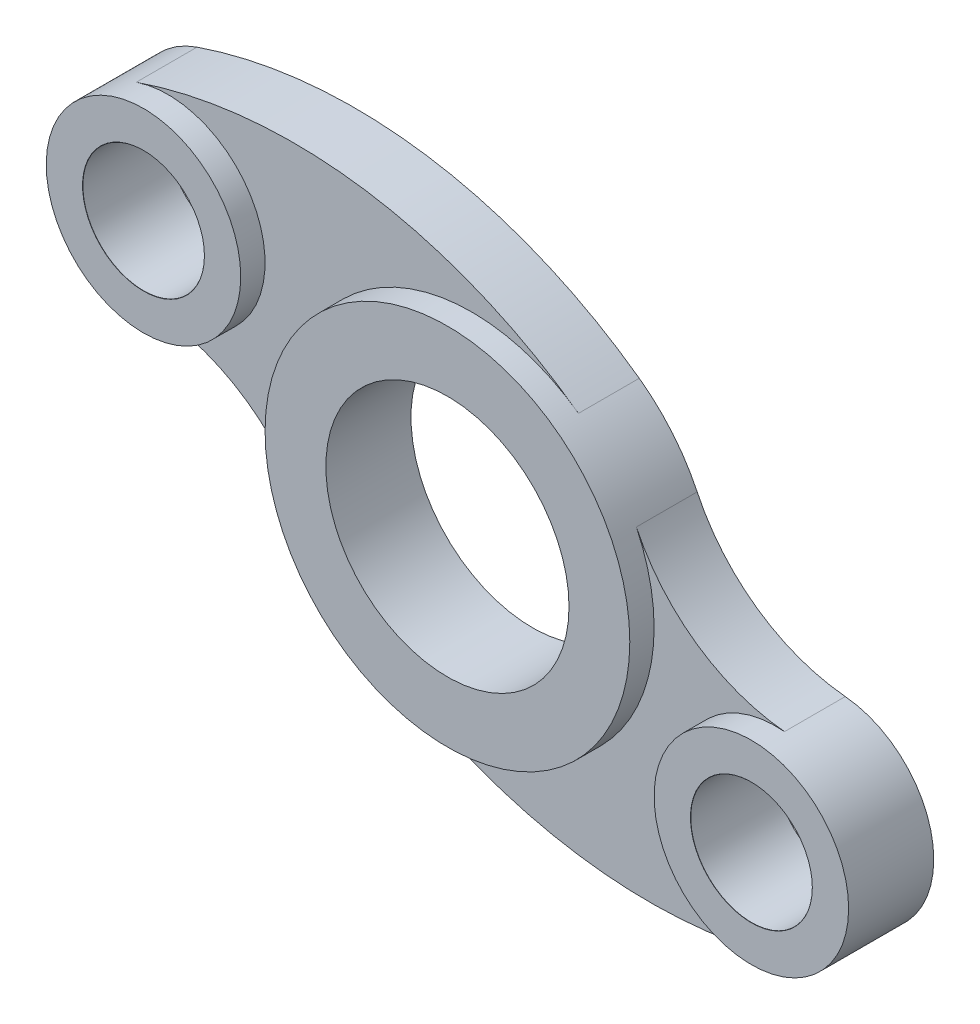
from build123d import *

# Parameters (mm, degrees)
ESTRUSIONE_ESTRUSIONE1_START = -5
SCHIZZO1_R                   = 16
ESTRUSIONE_ESTRUSIONE1_DEPTH = 14
ESTRUSIONE_ESTRUSIONE3_START = -5
SCHIZZO1_4_R                 = 16
ESTRUSIONE_ESTRUSIONE3_DEPTH = 14
ESTRUSIONE_ESTRUSIONE5_START = -5
SCHIZZO1_7_R                 = 30
ESTRUSIONE_ESTRUSIONE5_DEPTH = 14
ESTRUSIONE_ESTRUSIONE6_DEPTH = 5
ESTRUSIONE_ESTRUSIONE7_DEPTH = 5
FORO_20_0_20_1_D             = 20
FORO_20_0_20_1_CSINK_D       = 20.05
FORO_20_0_20_1_CSINK_ANGLE   = 90
TAGLIO_ESTRUSIONE1_START     = 9
SCHIZZO1_13_R                = 20
TAGLIO_ESTRUSIONE1_DEPTH     = 87.418617561


with BuildPart() as part:
    # Schizzo1 → Estrusione-Estrusione1 (new body)
    with BuildSketch(Plane.XY.offset(ESTRUSIONE_ESTRUSIONE1_START)):
        with Locations((-50, 20)):
            Circle(SCHIZZO1_R)
    extrude(amount=ESTRUSIONE_ESTRUSIONE1_DEPTH)



with BuildPart() as body_2:
    # Schizzo1<4> → Estrusione-Estrusione3 (new body)
    with BuildSketch(Plane.XY.offset(ESTRUSIONE_ESTRUSIONE3_START)):
        with Locations((50, -20)):
            Circle(SCHIZZO1_4_R)
    extrude(amount=ESTRUSIONE_ESTRUSIONE3_DEPTH)



with BuildPart() as body_3:
    # Schizzo1<7> → Estrusione-Estrusione5 (new body)
    with BuildSketch(Plane.XY.offset(ESTRUSIONE_ESTRUSIONE5_START)):
        Circle(SCHIZZO1_7_R)
    extrude(amount=ESTRUSIONE_ESTRUSIONE5_DEPTH)


with BuildPart() as body_2_1:
    add(body_2.part)

    add(body_3.part)  # Estrusione-Estrusione6 merges body 3
    # Schizzo1<11> → Estrusione-Estrusione6 (add, symmetric)
    with BuildSketch(Plane.XY):
        with BuildLine():
            ThreePointArc((27.082221172, 12.905552929), (29.26146472, 6.61563923), (30, 0))
            ThreePointArc((30, 0), (13.662924482, -26.708135364), (-17.554966307, -24.327415768))
            ThreePointArc((-17.554966307, -24.327415768), (17.499627211, -38.585427044), (55.185430705, -35.136423237))
            ThreePointArc((55.185430705, -35.136423237), (34.114481769, -21.910578587), (51.448501685, -4.06570231))
            ThreePointArc((51.448501685, -4.06570231), (37.018349838, 1.193804792), (27.082221172, 12.905552929))
        make_face()
    extrude(amount=ESTRUSIONE_ESTRUSIONE6_DEPTH, both=True)


with BuildPart() as part_1:
    add(part.part)

    add(body_2_1.part)  # Estrusione-Estrusione7 merges body 2
    # Schizzo1<12> → Estrusione-Estrusione7 (add, symmetric)
    with BuildSketch(Plane.XY):
        with BuildLine():
            ThreePointArc((-27.082221172, -12.905552929), (-19.216284557, 23.037673664), (17.554968706, 24.327414037))
            ThreePointArc((17.554968706, 24.327414037), (-17.499625748, 38.585426826), (-55.185430705, 35.136423237))
            ThreePointArc((-55.185430705, 35.136423237), (-40.698572456, 33.018580785), (-34, 20))
            ThreePointArc((-34, 20), (-39.210561343, 8.185262869), (-51.448501685, 4.06570231))
            ThreePointArc((-51.448501685, 4.06570231), (-37.018349838, -1.193804792), (-27.082221172, -12.905552929))
        make_face()
    extrude(amount=ESTRUSIONE_ESTRUSIONE7_DEPTH, both=True)

    # Foro Ø20.0 (20)-1 (through all)
    with Locations(Plane(origin=(-50, 20, 9), x_dir=(1, 0, 0), z_dir=(0, 0, 1))):
        with Locations((0, 0), (100, -40)):
            CounterSinkHole(FORO_20_0_20_1_D / 2, FORO_20_0_20_1_CSINK_D / 2, counter_sink_angle=FORO_20_0_20_1_CSINK_ANGLE)

    # Schizzo1<13> → Taglio-Estrusione1 (cut, through all)
    with BuildSketch(Plane.XY.offset(TAGLIO_ESTRUSIONE1_START)):
        Circle(SCHIZZO1_13_R)
    extrude(amount=-TAGLIO_ESTRUSIONE1_DEPTH, mode=Mode.SUBTRACT)


solid = part_1.part
